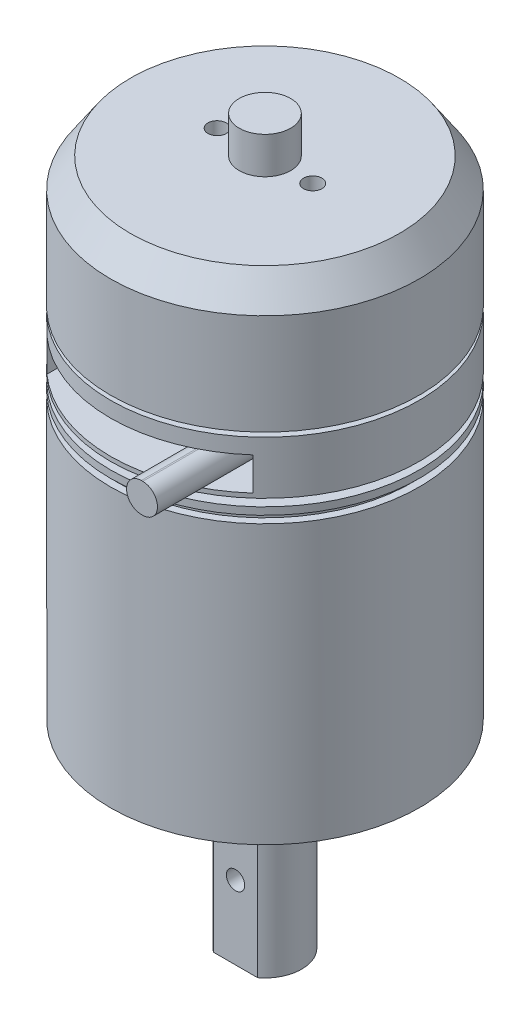
from build123d import *

# Parameters (mm, degrees)
SKETCH_2_W             = 28
SKETCH_2_H             = 4.5
CUT_EXTRUDE_1_DEPTH    = 10
EXTRUDE_1_DEPTH        = 15
HOLE_WIZARD_M3_1_D     = 2.5
HOLE_WIZARD_M3_1_DEPTH = 4
HOLE_WIZARD_M3_1_TIP   = 0.751075774
CUT_EXTRUDE_START      = -20
CUT_EXTRUDE_2_DEPTH    = 20
HOLE_WIZARD_M4_1_D     = 3.3
HOLE_WIZARD_M4_1_DEPTH = 10.1
HOLE_WIZARD_M4_1_TIP   = 0.991420021
HOLE_WIZARD_M3_2_D     = 2.5
HOLE_WIZARD_M5_1_D     = 4.2
HOLE_WIZARD_M5_1_DEPTH = 14
HOLE_WIZARD_M5_1_TIP   = 1.2618073
SCALE_1_SCALE          = 0.8
SCALE_2_SCALE          = 0.8
SCALE_3_SCALE          = 0.8


with BuildPart() as part:
    # 草图1 → 旋转1 (revolve)
    with BuildSketch(Plane.XY, mode=Mode.PRIVATE) as revolve_1_sk:
        Polygon((0, 0), (4.1, 0), (4.1, 6.7), (13.4, 6.7), (13.4, 8.7), (21, 8.7), (21, 10.2), (20, 10.2), (20, 11.2), (21, 11.2), (21, 12.2), (10, 12.2), (10, 13.2), (21, 13.2), (21, 20.4), (5, 20.4), (5, 21), (21, 21), (21, 34.7), (18.3, 38.7), (3.5, 38.7), (3.5, 43.7), (0, 43.7), align=None)
    revolve(revolve_1_sk.sketch.rotate(Axis((0, 43.7, 0), (0, -1, 0)), 90), axis=Axis((0, 43.7, 0), (0, -1, 0)))

    # 草图2 → 切除-拉伸1 (cut)
    with BuildSketch(Plane.XY.offset(21)):
        with Locations((0, 16.05)):
            Rectangle(SKETCH_2_W, SKETCH_2_H)
    extrude(amount=-CUT_EXTRUDE_1_DEPTH, mode=Mode.SUBTRACT)

    # 草图3 → 凸台-拉伸1 (add)
    with BuildSketch(Plane.XY.offset(11)):
        with BuildLine():
            Line((9.185056323, 18.053194417), (9.385056323, 18.053194417))
            ThreePointArc((9.385056323, 18.053194417), (11.385056323, 16.053194417), (9.385056323, 14.053194417))
            Line((9.385056323, 14.053194417), (9.185056323, 14.053194417))
            ThreePointArc((9.185056323, 14.053194417), (7.185056323, 16.053194417), (9.185056323, 18.053194417))
        make_face()
    extrude(amount=EXTRUDE_1_DEPTH)

    # M3 螺纹孔1
    with Locations(Plane(origin=(0, 38.7, 0), x_dir=(1, 0, 0), z_dir=(0, 1, 0))):
        with Locations((-6.5, 0), (6.5, 0)):
            Hole(HOLE_WIZARD_M3_1_D / 2, depth=HOLE_WIZARD_M3_1_DEPTH)
            with Locations((0, 0, -(HOLE_WIZARD_M3_1_DEPTH + HOLE_WIZARD_M3_1_TIP / 2))):  # 118° drill point
                Cone(0, HOLE_WIZARD_M3_1_D / 2, HOLE_WIZARD_M3_1_TIP, mode=Mode.SUBTRACT)

    # 草图7 → 旋转2 (revolve)
    with BuildSketch(Plane.XY, mode=Mode.PRIVATE) as revolve_2_sk:
        Polygon((0, -54.6), (5, -54.6), (5, -30.5), (8.275, -30.5), (8.275, -29.6), (13, -29.6), (13, -27.6), (21, -27.6), (21, 8.7), (0, 8.7), align=None)
    revolve(revolve_2_sk.sketch.rotate(Axis((0, 8.7, 0), (0, -1, 0)), 180), axis=Axis((0, 8.7, 0), (0, -1, 0)))

    # 草图8 → 切除-拉伸2 (cut)
    with BuildSketch(Plane.XZ.offset(54.6).offset(CUT_EXTRUDE_START)):
        with BuildLine():
            Line((-3, 4), (3, 4))
            ThreePointArc((3, 4), (0, 5), (-3, 4))
        make_face()
    extrude(amount=CUT_EXTRUDE_2_DEPTH, mode=Mode.SUBTRACT)

    # M4 螺纹孔1
    with Locations(Plane(origin=(0, -27.6, 0), x_dir=(-1, 0, 0), z_dir=(0, -1, 0))):
        with Locations((17.5, 0), (0, -17.5), (-17.5, 0), (0, 17.5)):
            Hole(HOLE_WIZARD_M4_1_D / 2, depth=HOLE_WIZARD_M4_1_DEPTH)
            with Locations((0, 0, -(HOLE_WIZARD_M4_1_DEPTH + HOLE_WIZARD_M4_1_TIP / 2))):  # 118° drill point
                Cone(0, HOLE_WIZARD_M4_1_D / 2, HOLE_WIZARD_M4_1_TIP, mode=Mode.SUBTRACT)

    # M3 螺纹孔2 (through all)
    with Locations(Plane(origin=(0, -44.6, 4), x_dir=(1, 0, 0), z_dir=(0, 0, 1))):
        with Locations((0, 0)):
            Hole(HOLE_WIZARD_M3_2_D / 2)

    # M5 螺纹孔1
    with Locations(Plane(origin=(0, -54.6, 0), x_dir=(-1, 0, 0), z_dir=(0, -1, 0))):
        with Locations((0, 0)):
            Hole(HOLE_WIZARD_M5_1_D / 2, depth=HOLE_WIZARD_M5_1_DEPTH)
            with Locations((0, 0, -(HOLE_WIZARD_M5_1_DEPTH + HOLE_WIZARD_M5_1_TIP / 2))):  # 118° drill point
                Cone(0, HOLE_WIZARD_M5_1_D / 2, HOLE_WIZARD_M5_1_TIP, mode=Mode.SUBTRACT)


with BuildPart() as part_1:
    # 缩放比例1: scaled about (0, 0, 0)
    add(part.part.scale(SCALE_1_SCALE))


with BuildPart() as part_2:
    # 缩放比例2: scaled about (0, 0, 0)
    add(part_1.part.scale(SCALE_2_SCALE))


with BuildPart() as part_3:
    # 缩放比例3: scaled about (0, 0, 0)
    add(part_2.part.scale(SCALE_3_SCALE))


solid = part_3.part
